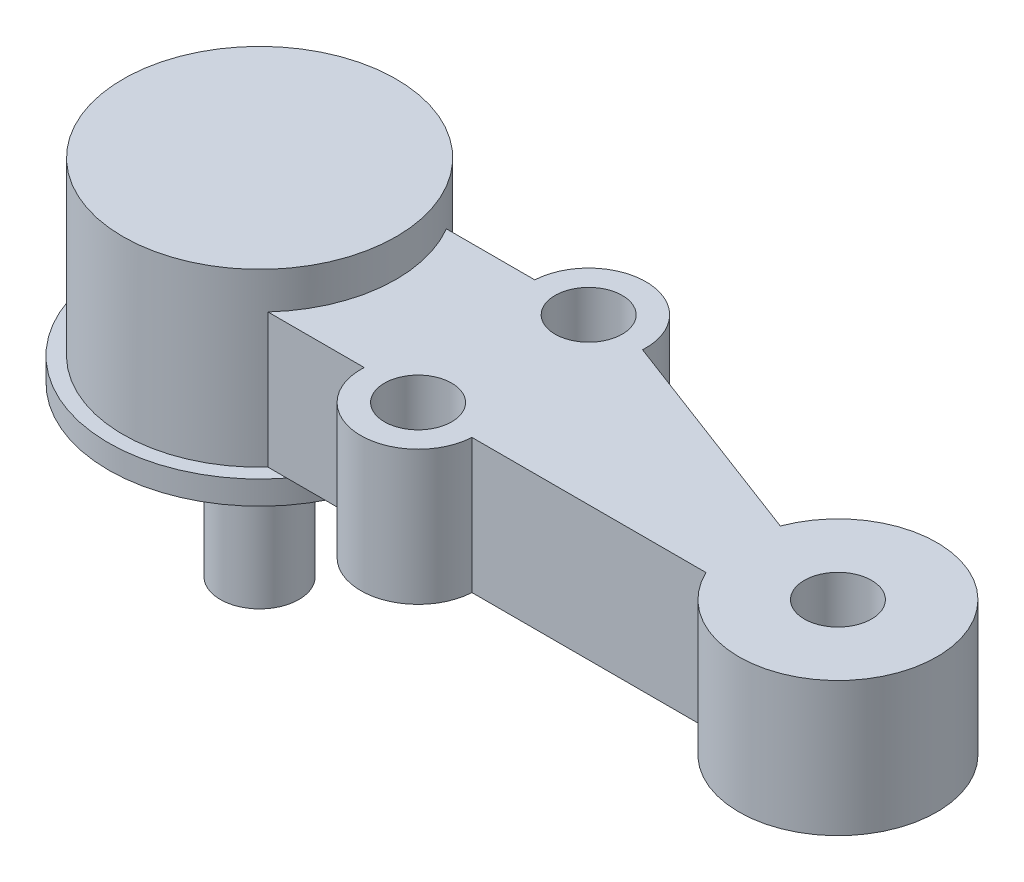
from build123d import *

# Parameters (mm, degrees)
SKETCH1_R           = 5
BOSS_EXTRUDE1_DEPTH = 20
SKETCH2_R           = 5
CUT_EXTRUDE1_DEPTH  = 75
SKETCH3_R           = 22.485447426
BOSS_EXTRUDE2_DEPTH = 3.5
SKETCH4_R           = 20.327044556
BOSS_EXTRUDE3_DEPTH = 5.5
SKETCH5_R           = 18.043078954
SKETCH5_R_2         = 5.853514337
CUT_EXTRUDE2_DEPTH  = 2
BOSS_EXTRUDE5_START = 25
SKETCH7_R           = 5.853514337
BOSS_EXTRUDE5_DEPTH = 25


with BuildPart() as part:
    # Sketch1 → Boss-Extrude1 (new body)
    with BuildSketch(Plane(origin=(0, 0, 0), x_dir=(1, 0, 0), z_dir=(0, 1, 0))):
        with BuildLine():
            Line((9.177252883, 11.533668593), (42.143741373, -0.928512909))
            ThreePointArc((42.143741373, -0.928512909), (70.658147952, -5.539619318), (42.614104982, -12.458097383))
            Line((42.614104982, -12.458097383), (7.783972854, -12.458097383))
            ThreePointArc((7.783972854, -12.458097383), (-1.224173666, -20.477404202), (-9.243480486, -11.469257682))
            Line((-9.243480486, -11.469257682), (-23.565055604, -11.469257682))
            ThreePointArc((-23.565055604, -11.469257682), (-58.758292474, 4.433528189), (-20.995467888, 12.522508294))
            Line((-20.995467888, 12.522508294), (-7.850200457, 12.522508294))
            ThreePointArc((-7.850200457, 12.522508294), (1.157946064, 20.541815114), (9.177252883, 11.533668593))
        make_face()
        with Locations(Location((0.663526213, 12.028088444, 0), (0, 0, 270))):
            Circle(SKETCH1_R, mode=Mode.SUBTRACT)
        with Locations(Location((-0.729753816, -11.963677532, 0), (0, 0, 270))):
            Circle(SKETCH1_R, mode=Mode.SUBTRACT)
    extrude(amount=BOSS_EXTRUDE1_DEPTH)

    # Sketch2 → Cut-Extrude1 (cut)
    with BuildSketch(Plane(origin=(0, 20, 0), x_dir=(1, 0, 0), z_dir=(0, 1, 0))):
        with Locations(Location((55.93095175, -6.140433438, 0), (0, 0, 270))):
            Circle(SKETCH2_R)
    extrude(amount=-CUT_EXTRUDE1_DEPTH, mode=Mode.SUBTRACT)

    # Sketch3 → Boss-Extrude2 (add)
    with BuildSketch(Plane.XZ):
        with Locations(Location((-38.546840471, -2.268823063, 0), (0, 0, 37.660146308))):
            Circle(SKETCH3_R)
    extrude(amount=BOSS_EXTRUDE2_DEPTH)

    # Sketch4 → Boss-Extrude3 (add)
    with BuildSketch(Plane(origin=(0, 20, 0), x_dir=(1, 0, 0), z_dir=(0, 1, 0))):
        with Locations(Location((-38.546840471, 2.268823063, 0), (0, 0, 30.293894425))):
            Circle(SKETCH4_R)
    extrude(amount=BOSS_EXTRUDE3_DEPTH)

    # Sketch5 → Cut-Extrude2 (cut)
    with BuildSketch(Plane.XZ.offset(3.5)):
        with Locations(Location((-38.546840471, -2.268823063, 0), (0, 0, 270))):
            Circle(SKETCH5_R)
        with Locations(Location((-38.546840471, -2.268823063, 0), (0, 0, 270))):
            Circle(SKETCH5_R_2, mode=Mode.SUBTRACT)
    extrude(amount=-CUT_EXTRUDE2_DEPTH, mode=Mode.SUBTRACT)

    # Sketch7 → Boss-Extrude5 (add)
    with BuildSketch(Plane.XZ.offset(3.5).offset(BOSS_EXTRUDE5_START)):
        with Locations(Location((-38.546840471, -2.268823063, 0), (0, 0, 270))):
            Circle(SKETCH7_R)
    extrude(amount=-BOSS_EXTRUDE5_DEPTH)


solid = part.part
